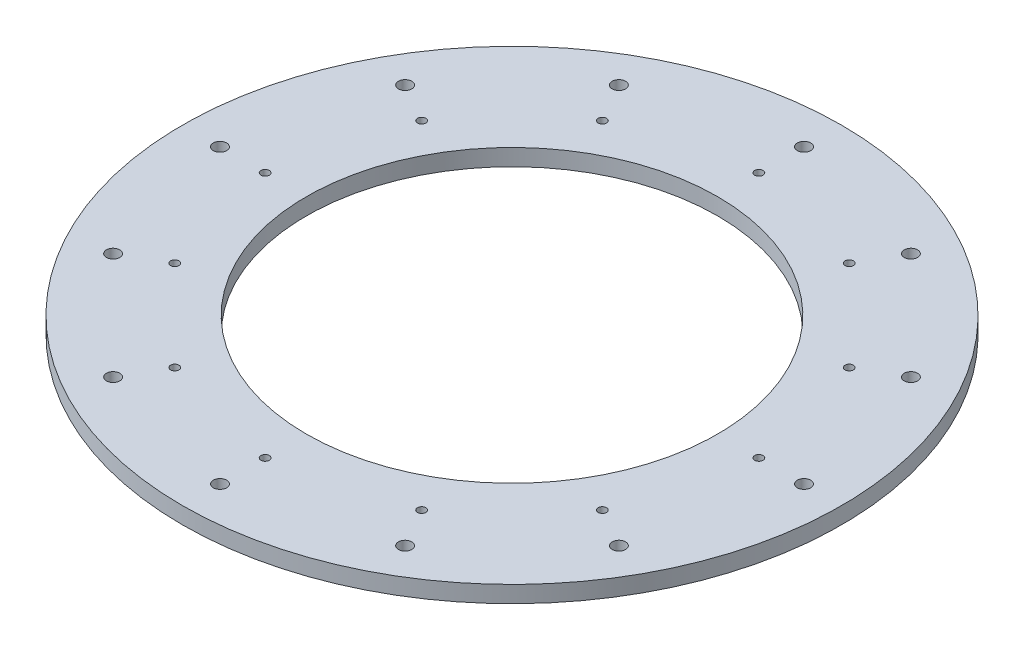
from build123d import *

# Parameters (mm, degrees)
SKETCH1_R           = 79
SKETCH1_R_2         = 1
SKETCH1_R_3         = 49.3
SKETCH1_R_4         = 1.6
BOSS_EXTRUDE1_DEPTH = 4


with BuildPart() as part:
    # Sketch1 → Boss-Extrude1 (new body)
    with BuildSketch(Plane(origin=(0, 0, 0), x_dir=(1, 0, 0), z_dir=(0, 1, 0))):
        with Locations(Location((0, 0, 0), (0, 0, 270))):
            Circle(SKETCH1_R)
        with Locations(Location((0, 59.18, 0), (0, 0, 270))):
            Circle(SKETCH1_R_2, mode=Mode.SUBTRACT)
        with Locations(Location((29.59, 51.251383396, 0), (0, 0, 270))):
            Circle(SKETCH1_R_2, mode=Mode.SUBTRACT)
        with Locations(Location((51.251383396, 29.59, 0), (0, 0, 270))):
            Circle(SKETCH1_R_2, mode=Mode.SUBTRACT)
        with Locations(Location((59.18, 0, 0), (0, 0, 270))):
            Circle(SKETCH1_R_2, mode=Mode.SUBTRACT)
        with Locations(Location((51.251383396, -29.59, 0), (0, 0, 270))):
            Circle(SKETCH1_R_2, mode=Mode.SUBTRACT)
        with Locations(Location((29.59, -51.251383396, 0), (0, 0, 270))):
            Circle(SKETCH1_R_2, mode=Mode.SUBTRACT)
        with Locations(Location((0, -59.18, 0), (0, 0, 270))):
            Circle(SKETCH1_R_2, mode=Mode.SUBTRACT)
        with Locations(Location((-29.59, -51.251383396, 0), (0, 0, 270))):
            Circle(SKETCH1_R_2, mode=Mode.SUBTRACT)
        with Locations(Location((-51.251383396, -29.59, 0), (0, 0, 270))):
            Circle(SKETCH1_R_2, mode=Mode.SUBTRACT)
        with Locations(Location((-59.18, 0, 0), (0, 0, 270))):
            Circle(SKETCH1_R_2, mode=Mode.SUBTRACT)
        with Locations(Location((-51.251383396, 29.59, 0), (0, 0, 270))):
            Circle(SKETCH1_R_2, mode=Mode.SUBTRACT)
        with Locations(Location((-29.59, 51.251383396, 0), (0, 0, 270))):
            Circle(SKETCH1_R_2, mode=Mode.SUBTRACT)
        with Locations(Location((0, 0, 0), (0, 0, 270))):
            Circle(SKETCH1_R_3, mode=Mode.SUBTRACT)
        with Locations(Location((0, 70, 0), (0, 0, 270))):
            Circle(SKETCH1_R_4, mode=Mode.SUBTRACT)
        with Locations(Location((35, 60.621778265, 0), (0, 0, 270))):
            Circle(SKETCH1_R_4, mode=Mode.SUBTRACT)
        with Locations(Location((60.621778265, 35, 0), (0, 0, 270))):
            Circle(SKETCH1_R_4, mode=Mode.SUBTRACT)
        with Locations(Location((70, 0, 0), (0, 0, 270))):
            Circle(SKETCH1_R_4, mode=Mode.SUBTRACT)
        with Locations(Location((60.621778265, -35, 0), (0, 0, 270))):
            Circle(SKETCH1_R_4, mode=Mode.SUBTRACT)
        with Locations(Location((35, -60.621778265, 0), (0, 0, 270))):
            Circle(SKETCH1_R_4, mode=Mode.SUBTRACT)
        with Locations(Location((0, -70, 0), (0, 0, 270))):
            Circle(SKETCH1_R_4, mode=Mode.SUBTRACT)
        with Locations(Location((-35, -60.621778265, 0), (0, 0, 270))):
            Circle(SKETCH1_R_4, mode=Mode.SUBTRACT)
        with Locations(Location((-60.621778265, -35, 0), (0, 0, 270))):
            Circle(SKETCH1_R_4, mode=Mode.SUBTRACT)
        with Locations(Location((-70, 0, 0), (0, 0, 270))):
            Circle(SKETCH1_R_4, mode=Mode.SUBTRACT)
        with Locations(Location((-60.621778265, 35, 0), (0, 0, 270))):
            Circle(SKETCH1_R_4, mode=Mode.SUBTRACT)
        with Locations(Location((-35, 60.621778265, 0), (0, 0, 270))):
            Circle(SKETCH1_R_4, mode=Mode.SUBTRACT)
    extrude(amount=BOSS_EXTRUDE1_DEPTH)


solid = part.part
